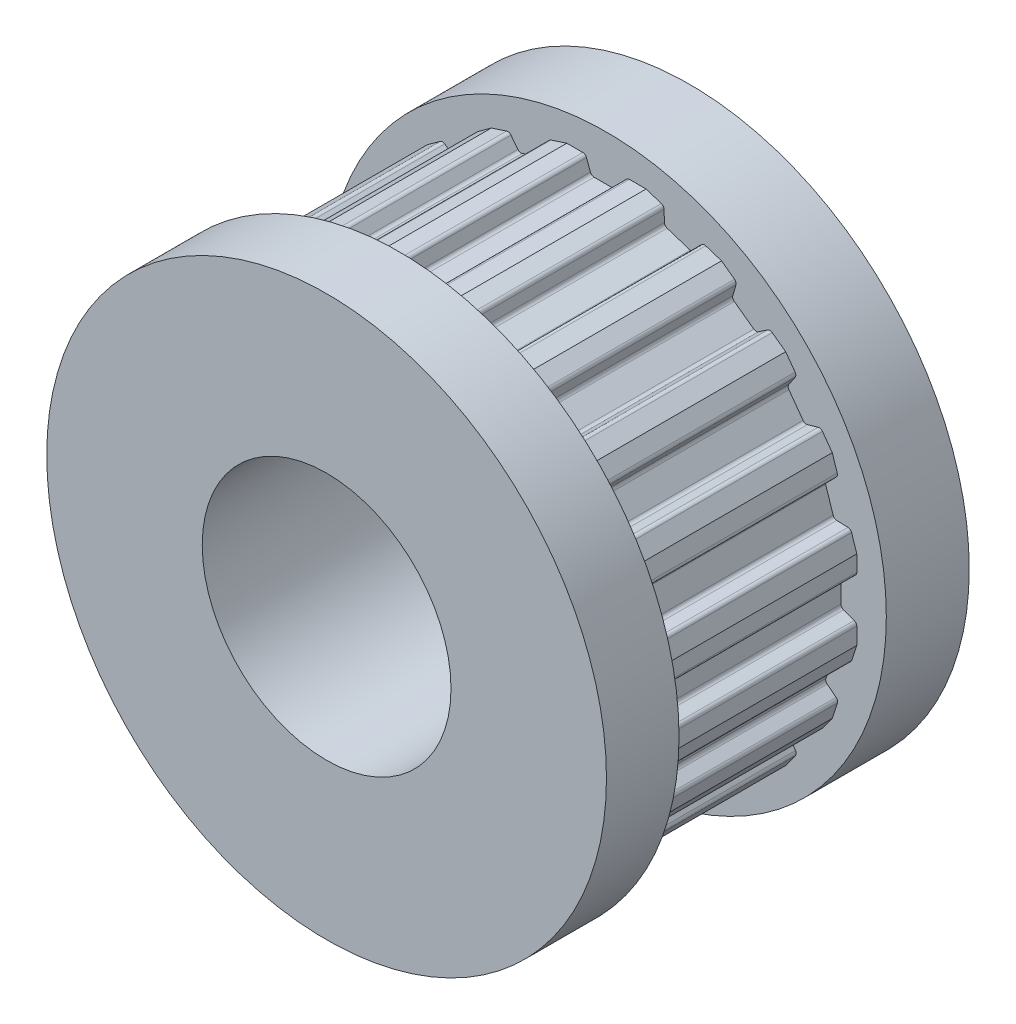
from build123d import *

# Parameters (mm, degrees)
BOSS_EXTRUDE1_DEPTH = 5
SKETCH3_R           = 6.75
BOSS_EXTRUDE2_DEPTH = 1.75
BOSS_EXTRUDE3_START = 2
SKETCH5_R           = 6.75
BOSS_EXTRUDE3_DEPTH = 2
SKETCH6_R           = 3
CUT_EXTRUDE1_DEPTH  = 59.687866344


with BuildPart() as part:
    # Sketch1 → Boss-Extrude1 (new body)
    with BuildSketch(Plane.XY):
        with BuildLine():
            Line((-50.740211824, 0.312716149), (-50.338690119, 0.312716149))
            ThreePointArc((-50.338690119, 0.312716149), (-50.284056963, 0.329941917), (-50.249184397, 0.37538873))
            Line((-50.249184397, 0.37538873), (-50.156133646, 0.631043568))
            ThreePointArc((-50.156133646, 0.631043568), (-50.121261079, 0.676490381), (-50.066627924, 0.693716149))
            Line((-50.066627924, 0.693716149), (-49.485486003, 0.693716149))
            ThreePointArc((-49.485486003, 0.693716149), (-49.430852847, 0.676490381), (-49.395980281, 0.631043568))
            Line((-49.395980281, 0.631043568), (-49.30292953, 0.37538873))
            ThreePointArc((-49.30292953, 0.37538873), (-49.268056963, 0.329941917), (-49.213423808, 0.312716149))
            Line((-49.213423808, 0.312716149), (-48.827788176, 0.312716149))
            Line((-48.827788176, 0.312716149), (-48.445918342, 0.436793179))
            ThreePointArc((-48.445918342, 0.436793179), (-48.399282179, 0.470058432), (-48.380160235, 0.524057135))
            Line((-48.380160235, 0.524057135), (-48.370665401, 0.795953598))
            ThreePointArc((-48.370665401, 0.795953598), (-48.351543457, 0.849952302), (-48.304907293, 0.883217554))
            Line((-48.304907293, 0.883217554), (-47.752208483, 1.062800284))
            ThreePointArc((-47.752208483, 1.062800284), (-47.694926209, 1.063300178), (-47.64771659, 1.030853906))
            Line((-47.64771659, 1.030853906), (-47.480218377, 0.81646597))
            ThreePointArc((-47.480218377, 0.81646597), (-47.433008758, 0.784019698), (-47.375726484, 0.784519593))
            Line((-47.375726484, 0.784519593), (-47.008965204, 0.903687556))
            Line((-47.008965204, 0.903687556), (-46.684127321, 1.139696093))
            ThreePointArc((-46.684127321, 1.139696093), (-46.650053222, 1.185744595), (-46.64855369, 1.24300942))
            Line((-46.64855369, 1.24300942), (-46.723544194, 1.504532387))
            ThreePointArc((-46.723544194, 1.504532387), (-46.722044662, 1.561797212), (-46.687970563, 1.607845714))
            Line((-46.687970563, 1.607845714), (-46.217816873, 1.949432365))
            ThreePointArc((-46.217816873, 1.949432365), (-46.163492669, 1.967608989), (-46.108567204, 1.951339325))
            Line((-46.108567204, 1.951339325), (-45.883017422, 1.799204076))
            ThreePointArc((-45.883017422, 1.799204076), (-45.828091956, 1.782934411), (-45.773767752, 1.801111036))
            Line((-45.773767752, 1.801111036), (-45.461781973, 2.027781973))
            Line((-45.461781973, 2.027781973), (-45.225773436, 2.352619856))
            ThreePointArc((-45.225773436, 2.352619856), (-45.207596812, 2.406944059), (-45.223866476, 2.461869525))
            Line((-45.223866476, 2.461869525), (-45.376001725, 2.687419307))
            ThreePointArc((-45.376001725, 2.687419307), (-45.392271389, 2.742344773), (-45.374094765, 2.796668976))
            Line((-45.374094765, 2.796668976), (-45.032508114, 3.266822666))
            ThreePointArc((-45.032508114, 3.266822666), (-44.986459612, 3.300896765), (-44.929194788, 3.302396297))
            Line((-44.929194788, 3.302396297), (-44.66767182, 3.227405793))
            ThreePointArc((-44.66767182, 3.227405793), (-44.610406995, 3.228905326), (-44.564358493, 3.262979425))
            Line((-44.564358493, 3.262979425), (-44.337687556, 3.574965204))
            Line((-44.337687556, 3.574965204), (-44.213610526, 3.956835038))
            ThreePointArc((-44.213610526, 3.956835038), (-44.213110631, 4.014117312), (-44.245556904, 4.061326931))
            Line((-44.245556904, 4.061326931), (-44.459944839, 4.228825144))
            ThreePointArc((-44.459944839, 4.228825144), (-44.492391112, 4.276034763), (-44.491891217, 4.333317037))
            Line((-44.491891217, 4.333317037), (-44.312308487, 4.886015847))
            ThreePointArc((-44.312308487, 4.886015847), (-44.279043235, 4.932652011), (-44.225044531, 4.951773955))
            Line((-44.225044531, 4.951773955), (-43.953148069, 4.961268788))
            ThreePointArc((-43.953148069, 4.961268788), (-43.899149365, 4.980390732), (-43.865884113, 5.027026896))
            Line((-43.865884113, 5.027026896), (-43.746716149, 5.393788176))
            Line((-43.746716149, 5.393788176), (-43.746716149, 5.795309881))
            ThreePointArc((-43.746716149, 5.795309881), (-43.763941917, 5.849943037), (-43.80938873, 5.884815603))
            Line((-43.80938873, 5.884815603), (-44.065043568, 5.977866354))
            ThreePointArc((-44.065043568, 5.977866354), (-44.110490381, 6.012738921), (-44.127716149, 6.067372076))
            Line((-44.127716149, 6.067372076), (-44.127716149, 6.648513997))
            ThreePointArc((-44.127716149, 6.648513997), (-44.110490381, 6.703147153), (-44.065043568, 6.738019719))
            Line((-44.065043568, 6.738019719), (-43.80938873, 6.83107047))
            ThreePointArc((-43.80938873, 6.83107047), (-43.763941917, 6.865943037), (-43.746716149, 6.920576192))
            Line((-43.746716149, 6.920576192), (-43.746716149, 7.306211824))
            Line((-43.746716149, 7.306211824), (-43.870793179, 7.688081658))
            ThreePointArc((-43.870793179, 7.688081658), (-43.904058432, 7.734717821), (-43.958057135, 7.753839765))
            Line((-43.958057135, 7.753839765), (-44.229953598, 7.763334599))
            ThreePointArc((-44.229953598, 7.763334599), (-44.283952302, 7.782456543), (-44.317217554, 7.829092707))
            Line((-44.317217554, 7.829092707), (-44.496800284, 8.381791517))
            ThreePointArc((-44.496800284, 8.381791517), (-44.497300178, 8.439073791), (-44.464853906, 8.48628341))
            Line((-44.464853906, 8.48628341), (-44.25046597, 8.653781623))
            ThreePointArc((-44.25046597, 8.653781623), (-44.218019698, 8.700991242), (-44.218519593, 8.758273516))
            Line((-44.218519593, 8.758273516), (-44.337687556, 9.125034796))
            Line((-44.337687556, 9.125034796), (-44.573696093, 9.449872679))
            ThreePointArc((-44.573696093, 9.449872679), (-44.619744595, 9.483946778), (-44.67700942, 9.48544631))
            Line((-44.67700942, 9.48544631), (-44.938532387, 9.410455806))
            ThreePointArc((-44.938532387, 9.410455806), (-44.995797212, 9.411955338), (-45.041845714, 9.446029437))
            Line((-45.041845714, 9.446029437), (-45.383432365, 9.916183127))
            ThreePointArc((-45.383432365, 9.916183127), (-45.401608989, 9.970507331), (-45.385339325, 10.025432796))
            Line((-45.385339325, 10.025432796), (-45.233204076, 10.250982578))
            ThreePointArc((-45.233204076, 10.250982578), (-45.216934411, 10.305908044), (-45.235111036, 10.360232248))
            Line((-45.235111036, 10.360232248), (-45.461781973, 10.672218027))
            Line((-45.461781973, 10.672218027), (-45.786619856, 10.908226564))
            ThreePointArc((-45.786619856, 10.908226564), (-45.840944059, 10.926403188), (-45.895869525, 10.910133524))
            Line((-45.895869525, 10.910133524), (-46.121419307, 10.757998275))
            ThreePointArc((-46.121419307, 10.757998275), (-46.176344773, 10.741728611), (-46.230668976, 10.759905235))
            Line((-46.230668976, 10.759905235), (-46.700822666, 11.101491886))
            ThreePointArc((-46.700822666, 11.101491886), (-46.734896765, 11.147540388), (-46.736396297, 11.204805212))
            Line((-46.736396297, 11.204805212), (-46.661405793, 11.46632818))
            ThreePointArc((-46.661405793, 11.46632818), (-46.662905326, 11.523593005), (-46.696979425, 11.569641507))
            Line((-46.696979425, 11.569641507), (-47.008965204, 11.796312444))
            Line((-47.008965204, 11.796312444), (-47.390835038, 11.920389474))
            ThreePointArc((-47.390835038, 11.920389474), (-47.448117312, 11.920889369), (-47.495326931, 11.888443096))
            Line((-47.495326931, 11.888443096), (-47.662825144, 11.674055161))
            ThreePointArc((-47.662825144, 11.674055161), (-47.710034763, 11.641608888), (-47.767317037, 11.642108783))
            Line((-47.767317037, 11.642108783), (-48.320015847, 11.821691513))
            ThreePointArc((-48.320015847, 11.821691513), (-48.366652011, 11.854956765), (-48.385773955, 11.908955469))
            Line((-48.385773955, 11.908955469), (-48.395268788, 12.180851931))
            ThreePointArc((-48.395268788, 12.180851931), (-48.414390732, 12.234850635), (-48.461026896, 12.268115887))
            Line((-48.461026896, 12.268115887), (-48.827788176, 12.387283851))
            Line((-48.827788176, 12.387283851), (-49.229309881, 12.387283851))
            ThreePointArc((-49.229309881, 12.387283851), (-49.283943037, 12.370058083), (-49.318815603, 12.32461127))
            Line((-49.318815603, 12.32461127), (-49.411866354, 12.068956432))
            ThreePointArc((-49.411866354, 12.068956432), (-49.446738921, 12.023509619), (-49.501372076, 12.006283851))
            Line((-49.501372076, 12.006283851), (-50.082513997, 12.006283851))
            ThreePointArc((-50.082513997, 12.006283851), (-50.137147153, 12.023509619), (-50.172019719, 12.068956432))
            Line((-50.172019719, 12.068956432), (-50.26507047, 12.32461127))
            ThreePointArc((-50.26507047, 12.32461127), (-50.299943037, 12.370058083), (-50.354576192, 12.387283851))
            Line((-50.354576192, 12.387283851), (-50.740211824, 12.387283851))
            Line((-50.740211824, 12.387283851), (-51.122081658, 12.263206821))
            ThreePointArc((-51.122081658, 12.263206821), (-51.168717821, 12.229941568), (-51.187839765, 12.175942865))
            Line((-51.187839765, 12.175942865), (-51.197334599, 11.904046402))
            ThreePointArc((-51.197334599, 11.904046402), (-51.216456543, 11.850047698), (-51.263092707, 11.816782446))
            Line((-51.263092707, 11.816782446), (-51.815791517, 11.637199716))
            ThreePointArc((-51.815791517, 11.637199716), (-51.873073791, 11.636699822), (-51.92028341, 11.669146094))
            Line((-51.92028341, 11.669146094), (-52.087781623, 11.88353403))
            ThreePointArc((-52.087781623, 11.88353403), (-52.134991242, 11.915980302), (-52.192273516, 11.915480407))
            Line((-52.192273516, 11.915480407), (-52.559034796, 11.796312444))
            Line((-52.559034796, 11.796312444), (-52.883872679, 11.560303907))
            ThreePointArc((-52.883872679, 11.560303907), (-52.917946778, 11.514255405), (-52.91944631, 11.45699058))
            Line((-52.91944631, 11.45699058), (-52.844455806, 11.195467613))
            ThreePointArc((-52.844455806, 11.195467613), (-52.845955338, 11.138202788), (-52.880029437, 11.092154286))
            Line((-52.880029437, 11.092154286), (-53.350183127, 10.750567635))
            ThreePointArc((-53.350183127, 10.750567635), (-53.404507331, 10.732391011), (-53.459432796, 10.748660675))
            Line((-53.459432796, 10.748660675), (-53.684982578, 10.900795924))
            ThreePointArc((-53.684982578, 10.900795924), (-53.739908044, 10.917065589), (-53.794232248, 10.898888964))
            Line((-53.794232248, 10.898888964), (-54.106218027, 10.672218027))
            Line((-54.106218027, 10.672218027), (-54.342226564, 10.347380144))
            ThreePointArc((-54.342226564, 10.347380144), (-54.360403188, 10.293055941), (-54.344133524, 10.238130475))
            Line((-54.344133524, 10.238130475), (-54.191998275, 10.012580693))
            ThreePointArc((-54.191998275, 10.012580693), (-54.175728611, 9.957655227), (-54.193905235, 9.903331024))
            Line((-54.193905235, 9.903331024), (-54.535491886, 9.433177334))
            ThreePointArc((-54.535491886, 9.433177334), (-54.581540388, 9.399103235), (-54.638805212, 9.397603703))
            Line((-54.638805212, 9.397603703), (-54.90032818, 9.472594207))
            ThreePointArc((-54.90032818, 9.472594207), (-54.957593005, 9.471094674), (-55.003641507, 9.437020575))
            Line((-55.003641507, 9.437020575), (-55.230312444, 9.125034796))
            Line((-55.230312444, 9.125034796), (-55.354389474, 8.743164962))
            ThreePointArc((-55.354389474, 8.743164962), (-55.354889369, 8.685882688), (-55.322443096, 8.638673069))
            Line((-55.322443096, 8.638673069), (-55.108055161, 8.471174856))
            ThreePointArc((-55.108055161, 8.471174856), (-55.075608888, 8.423965237), (-55.076108783, 8.366682963))
            Line((-55.076108783, 8.366682963), (-55.255691513, 7.813984153))
            ThreePointArc((-55.255691513, 7.813984153), (-55.288956765, 7.767347989), (-55.342955469, 7.748226045))
            Line((-55.342955469, 7.748226045), (-55.614851931, 7.738731212))
            ThreePointArc((-55.614851931, 7.738731212), (-55.668850635, 7.719609268), (-55.702115887, 7.672973104))
            Line((-55.702115887, 7.672973104), (-55.821283851, 7.306211824))
            Line((-55.821283851, 7.306211824), (-55.821283851, 6.904690119))
            ThreePointArc((-55.821283851, 6.904690119), (-55.804058083, 6.850056963), (-55.75861127, 6.815184397))
            Line((-55.75861127, 6.815184397), (-55.502956432, 6.722133646))
            ThreePointArc((-55.502956432, 6.722133646), (-55.457509619, 6.687261079), (-55.440283851, 6.632627924))
            Line((-55.440283851, 6.632627924), (-55.440283851, 6.051486003))
            ThreePointArc((-55.440283851, 6.051486003), (-55.457509619, 5.996852847), (-55.502956432, 5.961980281))
            Line((-55.502956432, 5.961980281), (-55.75861127, 5.86892953))
            ThreePointArc((-55.75861127, 5.86892953), (-55.804058083, 5.834056963), (-55.821283851, 5.779423808))
            Line((-55.821283851, 5.779423808), (-55.821283851, 5.393788176))
            Line((-55.821283851, 5.393788176), (-55.697206821, 5.011918342))
            ThreePointArc((-55.697206821, 5.011918342), (-55.663941568, 4.965282179), (-55.609942865, 4.946160235))
            Line((-55.609942865, 4.946160235), (-55.338046402, 4.936665401))
            ThreePointArc((-55.338046402, 4.936665401), (-55.284047698, 4.917543457), (-55.250782446, 4.870907293))
            Line((-55.250782446, 4.870907293), (-55.071199716, 4.318208483))
            ThreePointArc((-55.071199716, 4.318208483), (-55.070699822, 4.260926209), (-55.103146094, 4.21371659))
            Line((-55.103146094, 4.21371659), (-55.31753403, 4.046218377))
            ThreePointArc((-55.31753403, 4.046218377), (-55.349980302, 3.999008758), (-55.349480407, 3.941726484))
            Line((-55.349480407, 3.941726484), (-55.230312444, 3.574965204))
            Line((-55.230312444, 3.574965204), (-54.994303907, 3.250127321))
            ThreePointArc((-54.994303907, 3.250127321), (-54.948255405, 3.216053222), (-54.89099058, 3.21455369))
            Line((-54.89099058, 3.21455369), (-54.629467613, 3.289544194))
            ThreePointArc((-54.629467613, 3.289544194), (-54.572202788, 3.288044662), (-54.526154286, 3.253970563))
            Line((-54.526154286, 3.253970563), (-54.184567635, 2.783816873))
            ThreePointArc((-54.184567635, 2.783816873), (-54.166391011, 2.729492669), (-54.182660675, 2.674567204))
            Line((-54.182660675, 2.674567204), (-54.334795924, 2.449017422))
            ThreePointArc((-54.334795924, 2.449017422), (-54.351065589, 2.394091956), (-54.332888964, 2.339767752))
            Line((-54.332888964, 2.339767752), (-54.106218027, 2.027781973))
            Line((-54.106218027, 2.027781973), (-53.781380144, 1.791773436))
            ThreePointArc((-53.781380144, 1.791773436), (-53.727055941, 1.773596812), (-53.672130475, 1.789866476))
            Line((-53.672130475, 1.789866476), (-53.446580693, 1.942001725))
            ThreePointArc((-53.446580693, 1.942001725), (-53.391655227, 1.958271389), (-53.337331024, 1.940094765))
            Line((-53.337331024, 1.940094765), (-52.867177334, 1.598508114))
            ThreePointArc((-52.867177334, 1.598508114), (-52.833103235, 1.552459612), (-52.831603703, 1.495194788))
            Line((-52.831603703, 1.495194788), (-52.906594207, 1.23367182))
            ThreePointArc((-52.906594207, 1.23367182), (-52.905094674, 1.176406995), (-52.871020575, 1.130358493))
            Line((-52.871020575, 1.130358493), (-52.559034796, 0.903687556))
            Line((-52.559034796, 0.903687556), (-52.177164962, 0.779610526))
            ThreePointArc((-52.177164962, 0.779610526), (-52.119882688, 0.779110631), (-52.072673069, 0.811556904))
            Line((-52.072673069, 0.811556904), (-51.905174856, 1.025944839))
            ThreePointArc((-51.905174856, 1.025944839), (-51.857965237, 1.058391112), (-51.800682963, 1.057891217))
            Line((-51.800682963, 1.057891217), (-51.247984153, 0.878308487))
            ThreePointArc((-51.247984153, 0.878308487), (-51.201347989, 0.845043235), (-51.182226045, 0.791044531))
            Line((-51.182226045, 0.791044531), (-51.172731212, 0.519148069))
            ThreePointArc((-51.172731212, 0.519148069), (-51.153609268, 0.465149365), (-51.106973104, 0.431884113))
            Line((-51.106973104, 0.431884113), (-50.740211824, 0.312716149))
        make_face()
    extrude(amount=BOSS_EXTRUDE1_DEPTH)

    # Sketch3 → Boss-Extrude2 (add)
    with BuildSketch(Plane.XY.offset(5)):
        with Locations((-49.784, 6.35)):
            Circle(SKETCH3_R)
    extrude(amount=BOSS_EXTRUDE2_DEPTH)

    # Sketch5 → Boss-Extrude3 (add)
    with BuildSketch(Plane(origin=(0, 0, 0), x_dir=(-1, 0, 0), z_dir=(0, 0, -1)).offset(BOSS_EXTRUDE3_START)):
        with Locations(Location((49.784, 6.35, 0), (0, 0, 180))):
            Circle(SKETCH5_R)
    extrude(amount=-BOSS_EXTRUDE3_DEPTH)

    # Sketch6 → Cut-Extrude1 (cut, through all)
    with BuildSketch(Plane(origin=(0, 0, -2), x_dir=(-1, 0, 0), z_dir=(0, 0, -1))):
        with Locations((49.784, 6.35)):
            Circle(SKETCH6_R)
    extrude(amount=-CUT_EXTRUDE1_DEPTH, mode=Mode.SUBTRACT)


solid = part.part
